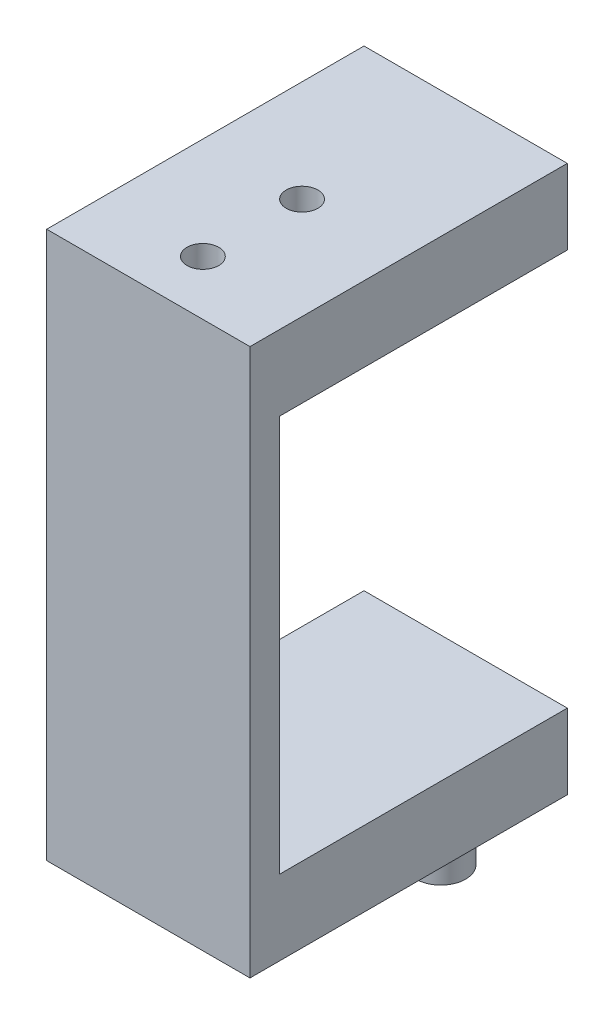
from build123d import *

# Parameters (mm, degrees)
SKETCH_1_W          = 20.5
SKETCH_1_H          = 15.141704846
SKETCH_1_R          = 2
EXTRUDE_1_DEPTH     = 29
SKETCH_2_W          = 20.5
SKETCH_2_H          = 70.283409692
EXTRUDE_2_DEPTH     = 3
SKETCH_3_W          = 20.5
SKETCH_3_H          = 7.570852423
CUT_EXTRUDE_1_DEPTH = 49.621002864
SKETCH_5_R          = 2.5
EXTRUDE_3_DEPTH     = 10
CUT_EXTRUDE_2_REACH = 75.297
SKETCH_8_R          = 1.6


with BuildPart() as part:
    # 草图1 → 凸台-拉伸1 (new body)
    # profile 1 of 3: a face of its own
    with BuildSketch(Plane.XY):
        with BuildLine():
            Line((-10.25, 35.141704846), (-10.25, 20))
            Line((-10.25, 20), (-5, 20))
            Line((-5, 20), (-5, 23))
            ThreePointArc((-5, 23), (-6.414213562, 26.414213562), (-3, 25))
            Line((-3, 25), (3, 25))
            ThreePointArc((3, 25), (5, 27), (7, 25))
            ThreePointArc((7, 25), (6.414213562, 23.585786438), (5, 23))
            Line((5, 23), (5, 20))
            Line((5, 20), (10.25, 20))
            Line((10.25, 20), (10.25, 35.141704846))
            Line((10.25, 35.141704846), (-10.25, 35.141704846))
        make_face()
    # profile 2 of 3: a face of its own
    with BuildSketch(Plane.XY):
        with Locations((0, -27.570852423)):
            Rectangle(SKETCH_1_W, SKETCH_1_H)
        with Locations(Location((-5, -25, 0), (0, 0, 180))):
            Circle(SKETCH_1_R, mode=Mode.SUBTRACT)
        with Locations(Location((5, -25, 0), (0, 0, 180))):
            Circle(SKETCH_1_R, mode=Mode.SUBTRACT)
    # profile 3 of 3: a face of its own
    with BuildSketch(Plane.XY):
        with BuildLine():
            Line((-5, 23), (-5, 20))
            Line((-5, 20), (5, 20))
            Line((5, 20), (5, 23))
            ThreePointArc((5, 23), (3.585786438, 23.585786438), (3, 25))
            Line((3, 25), (-3, 25))
            ThreePointArc((-3, 25), (-3.585786438, 23.585786438), (-5, 23))
        make_face()
    extrude(amount=EXTRUDE_1_DEPTH)

    # 草图2 → 凸台-拉伸2 (add)
    with BuildSketch(Plane.XY.offset(29)):
        Rectangle(SKETCH_2_W, SKETCH_2_H)
    extrude(amount=EXTRUDE_2_DEPTH)

    # 草图3 → 切除-拉伸1 (cut, through all)
    with BuildSketch(Plane(origin=(0, 0, 0), x_dir=(-1, 0, 0), z_dir=(0, 0, -1))):
        with Locations((0, -31.356278635)):
            Rectangle(SKETCH_3_W, SKETCH_3_H)
        with Locations((0, 31.356278635)):
            Rectangle(SKETCH_3_W, SKETCH_3_H)
    extrude(amount=-CUT_EXTRUDE_1_DEPTH, mode=Mode.SUBTRACT)

    # 草图5 → 凸台-拉伸3 (add)
    with BuildSketch(Plane.XZ.offset(27.570852423)):
        with Locations(Location((0, 2.5, 0), (0, 0, 270))):
            Circle(SKETCH_5_R)
    extrude(amount=EXTRUDE_3_DEPTH)

    # 草图8 → 切除-拉伸2 (cut, up to next)
    with BuildSketch(Plane(origin=(0, 27.570852423, 0), x_dir=(1, 0, 0), z_dir=(0, 1, 0)), mode=Mode.PRIVATE) as cut_extrude_2_sk1:
        with Locations(Location((0, -16.5, 0), (0, 0, 270))):
            Circle(SKETCH_8_R)
    cut_extrude_2_tool1 = extrude(cut_extrude_2_sk1.sketch, amount=-CUT_EXTRUDE_2_REACH, mode=Mode.PRIVATE) & part.part
    # 草图8 → 切除-拉伸2 (cut, up to next)
    with BuildSketch(Plane(origin=(0, 27.570852423, 0), x_dir=(1, 0, 0), z_dir=(0, 1, 0)), mode=Mode.PRIVATE) as cut_extrude_2_sk2:
        with Locations(Location((0, -26.5, 0), (0, 0, 270))):
            Circle(SKETCH_8_R)
    cut_extrude_2_tool2 = extrude(cut_extrude_2_sk2.sketch, amount=-CUT_EXTRUDE_2_REACH, mode=Mode.PRIVATE) & part.part
    add(cut_extrude_2_tool1.solids().sort_by_distance((0, 27.570852, 16.5))[0], mode=Mode.SUBTRACT)
    add(cut_extrude_2_tool2.solids().sort_by_distance((0, 27.570852, 26.5))[0], mode=Mode.SUBTRACT)


solid = part.part
